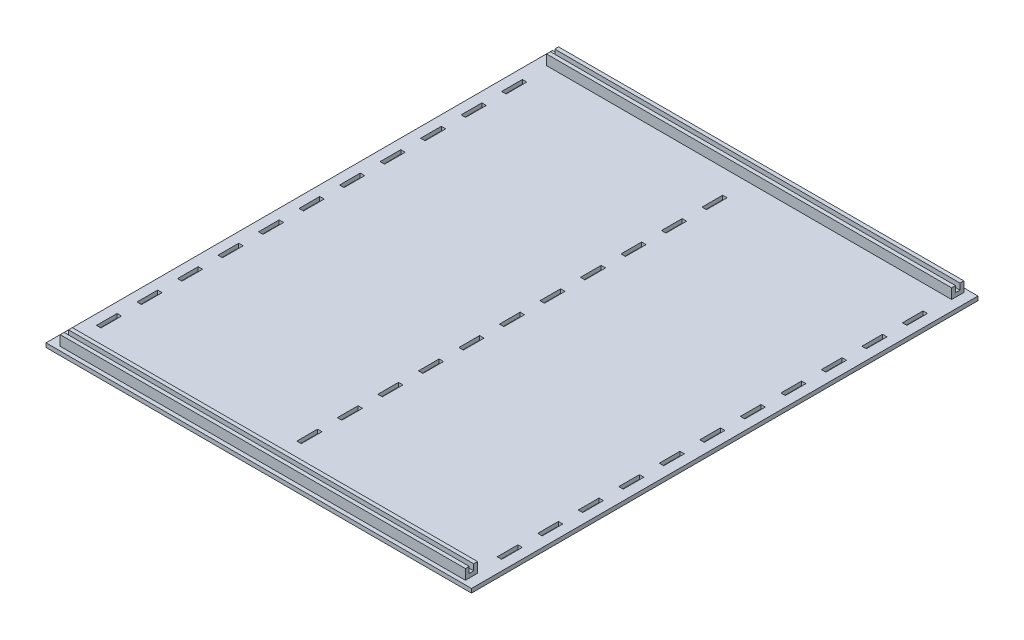
from build123d import *

# Parameters (mm, degrees)
SKETCH1_W           = 210
SKETCH1_H           = 250
BOSS_EXTRUDE1_DEPTH = 2
SKETCH2_W           = 200
SKETCH2_H           = 6
BOSS_EXTRUDE2_DEPTH = 5
SKETCH5_W           = 200
SKETCH5_H           = 2.2
CUT_EXTRUDE1_DEPTH  = 3
SKETCH6_W           = 200
SKETCH6_H           = 6
BOSS_EXTRUDE3_DEPTH = 5
SKETCH7_W           = 200
SKETCH7_H           = 2.2
CUT_EXTRUDE2_DEPTH  = 3
SKETCH_2_W          = 2.2
SKETCH_2_H          = 10.2
CUT_EXTRUDE_3_DEPTH = 164.324829711


with BuildPart() as part:
    # Sketch1 → Boss-Extrude1 (new body)
    with BuildSketch(Plane(origin=(0, 0, 0), x_dir=(1, 0, 0), z_dir=(0, 1, 0))):
        Rectangle(SKETCH1_W, SKETCH1_H)
    extrude(amount=BOSS_EXTRUDE1_DEPTH)

    # Sketch2 → Boss-Extrude2 (add)
    with BuildSketch(Plane(origin=(0, 2, 0), x_dir=(1, 0, 0), z_dir=(0, 1, 0))):
        with Locations((0, -120)):
            Rectangle(SKETCH2_W, SKETCH2_H)
    extrude(amount=BOSS_EXTRUDE2_DEPTH)

    # Sketch5 → Cut-Extrude1 (cut)
    with BuildSketch(Plane(origin=(0, 7, 0), x_dir=(1, 0, 0), z_dir=(0, 1, 0))):
        with Locations((0, -120)):
            Rectangle(SKETCH5_W, SKETCH5_H)
    extrude(amount=-CUT_EXTRUDE1_DEPTH, mode=Mode.SUBTRACT)

    # Sketch6 → Boss-Extrude3 (add)
    with BuildSketch(Plane(origin=(0, 2, 0), x_dir=(1, 0, 0), z_dir=(0, 1, 0))):
        with Locations((0, 120)):
            Rectangle(SKETCH6_W, SKETCH6_H)
    extrude(amount=BOSS_EXTRUDE3_DEPTH)

    # Sketch7 → Cut-Extrude2 (cut)
    with BuildSketch(Plane(origin=(0, 7, 0), x_dir=(1, 0, 0), z_dir=(0, 1, 0))):
        with Locations((0, 120)):
            Rectangle(SKETCH7_W, SKETCH7_H)
    extrude(amount=-CUT_EXTRUDE2_DEPTH, mode=Mode.SUBTRACT)

    # 草图2 → 切除-拉伸3 (cut, through all)
    with BuildSketch(Plane(origin=(0, 2, 0), x_dir=(1, 0, 0), z_dir=(0, 1, 0))):
        with Locations((0, -20)):
            Rectangle(SKETCH_2_W, SKETCH_2_H)
        Rectangle(SKETCH_2_W, SKETCH_2_H)
        with Locations((0, 20)):
            Rectangle(SKETCH_2_W, SKETCH_2_H)
        with Locations((0, 40)):
            Rectangle(SKETCH_2_W, SKETCH_2_H)
        with Locations((0, 60)):
            Rectangle(SKETCH_2_W, SKETCH_2_H)
        with Locations((0, 80)):
            Rectangle(SKETCH_2_W, SKETCH_2_H)
        with Locations((0, 100)):
            Rectangle(SKETCH_2_W, SKETCH_2_H)
        with Locations((0, -40)):
            Rectangle(SKETCH_2_W, SKETCH_2_H)
        with Locations((0, -60)):
            Rectangle(SKETCH_2_W, SKETCH_2_H)
        with Locations((0, -80)):
            Rectangle(SKETCH_2_W, SKETCH_2_H)
        with Locations((0, -100)):
            Rectangle(SKETCH_2_W, SKETCH_2_H)
        with Locations((98.9, 0)):
            Rectangle(SKETCH_2_W, SKETCH_2_H)
        with Locations((98.9, 20)):
            Rectangle(SKETCH_2_W, SKETCH_2_H)
        with Locations((-98.9, 0)):
            Rectangle(SKETCH_2_W, SKETCH_2_H)
        with Locations((98.9, 40)):
            Rectangle(SKETCH_2_W, SKETCH_2_H)
        with Locations((98.9, 60)):
            Rectangle(SKETCH_2_W, SKETCH_2_H)
        with Locations((98.9, 80)):
            Rectangle(SKETCH_2_W, SKETCH_2_H)
        with Locations((98.9, 100)):
            Rectangle(SKETCH_2_W, SKETCH_2_H)
        with Locations((98.9, -20)):
            Rectangle(SKETCH_2_W, SKETCH_2_H)
        with Locations((98.9, -40)):
            Rectangle(SKETCH_2_W, SKETCH_2_H)
        with Locations((98.9, -60)):
            Rectangle(SKETCH_2_W, SKETCH_2_H)
        with Locations((98.9, -80)):
            Rectangle(SKETCH_2_W, SKETCH_2_H)
        with Locations((98.9, -100)):
            Rectangle(SKETCH_2_W, SKETCH_2_H)
        with Locations((-98.9, 20)):
            Rectangle(SKETCH_2_W, SKETCH_2_H)
        with Locations((-98.9, 40)):
            Rectangle(SKETCH_2_W, SKETCH_2_H)
        with Locations((-98.9, 60)):
            Rectangle(SKETCH_2_W, SKETCH_2_H)
        with Locations((-98.9, 80)):
            Rectangle(SKETCH_2_W, SKETCH_2_H)
        with Locations((-98.9, 100)):
            Rectangle(SKETCH_2_W, SKETCH_2_H)
        with Locations((-98.9, -20)):
            Rectangle(SKETCH_2_W, SKETCH_2_H)
        with Locations((-98.9, -40)):
            Rectangle(SKETCH_2_W, SKETCH_2_H)
        with Locations((-98.9, -60)):
            Rectangle(SKETCH_2_W, SKETCH_2_H)
        with Locations((-98.9, -80)):
            Rectangle(SKETCH_2_W, SKETCH_2_H)
        with Locations((-98.9, -100)):
            Rectangle(SKETCH_2_W, SKETCH_2_H)
    extrude(amount=-CUT_EXTRUDE_3_DEPTH, mode=Mode.SUBTRACT)


solid = part.part
